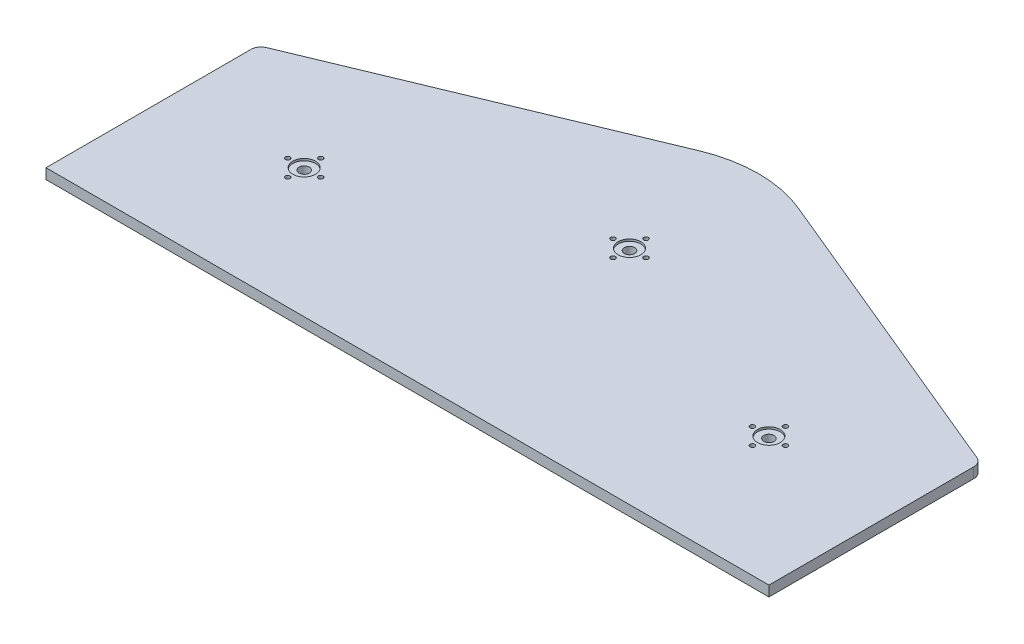
from build123d import *

# Parameters (mm, degrees)
ESQUISSE1_R                                        = 5
BOSS_EXTRU_1_DEPTH                                 = 10
ESQUISSE2_R                                        = 11
ENL_V_MAT_EXTRU_1_DEPTH                            = 2
CHAMBRAGE_POUR_VIS_T_TE_HEXAGONALE_M41_D           = 4.5
CHAMBRAGE_POUR_VIS_T_TE_HEXAGONALE_M41_CBORE_D     = 8
CHAMBRAGE_POUR_VIS_T_TE_HEXAGONALE_M41_CBORE_DEPTH = 4.4
R_P_TITION_CIRCULAIRE1_COUNT                       = 4
CHAMBRAGE_POUR_VIS_T_TE_HEXAGONALE_M42_D           = 4.5
CHAMBRAGE_POUR_VIS_T_TE_HEXAGONALE_M42_CBORE_D     = 8
CHAMBRAGE_POUR_VIS_T_TE_HEXAGONALE_M42_CBORE_DEPTH = 4.4
CHAMBRAGE_POUR_VIS_T_TE_HEXAGONALE_M43_D           = 4.5
CHAMBRAGE_POUR_VIS_T_TE_HEXAGONALE_M43_CBORE_D     = 8
CHAMBRAGE_POUR_VIS_T_TE_HEXAGONALE_M43_CBORE_DEPTH = 4.4
R_P_TITION_CIRCULAIRE2_COUNT                       = 4
R_P_TITION_CIRCULAIRE3_COUNT                       = 4


with BuildPart() as part:
    # Esquisse1 → Boss.-Extru.1 (new body)
    with BuildSketch(Plane(origin=(0, 0, 0), x_dir=(1, 0, 0), z_dir=(0, 1, 0))):
        with BuildLine():
            Line((350, 0), (-350, 0))
            Line((-350, 0), (-350, 198.324835183))
            ThreePointArc((-350, 198.324835183), (-348.317239297, 203.876729496), (-343.835293906, 207.560121895))
            Line((-343.835293906, 207.560121895), (-47.941173826, 330.441083901))
            ThreePointArc((-47.941173826, 330.441083901), (0, 340), (47.941173826, 330.441083901))
            Line((47.941173826, 330.441083901), (343.835293906, 207.560121895))
            ThreePointArc((343.835293906, 207.560121895), (348.317239297, 203.876729496), (350, 198.324835183))
            Line((350, 198.324835183), (350, 0))
        make_face()
        with Locations((0, 215)):
            Circle(ESQUISSE1_R, mode=Mode.SUBTRACT)
        with Locations((-225, 125)):
            Circle(ESQUISSE1_R, mode=Mode.SUBTRACT)
        with Locations((225, 125)):
            Circle(ESQUISSE1_R, mode=Mode.SUBTRACT)
    extrude(amount=BOSS_EXTRU_1_DEPTH)

    # Esquisse2 → Enlèv. mat.-Extru.1 (cut)
    with BuildSketch(Plane(origin=(0, 10, 0), x_dir=(1, 0, 0), z_dir=(0, 1, 0))):
        with Locations((0, 215)):
            Circle(ESQUISSE2_R)
        with Locations((225, 125)):
            Circle(ESQUISSE2_R)
        with Locations((-225, 125)):
            Circle(ESQUISSE2_R)
    extrude(amount=-ENL_V_MAT_EXTRU_1_DEPTH, mode=Mode.SUBTRACT)

    # Chambrage pour vis à tête hexagonale M41 (through all)
    with Locations(Plane(origin=(0, 0, 0), x_dir=(-1, 0, 0), z_dir=(0, -1, 0))):
        with Locations((-225, 141)):
            chambrage_pour_vis_t_te_hexagonale_m41 = CounterBoreHole(CHAMBRAGE_POUR_VIS_T_TE_HEXAGONALE_M41_D / 2, CHAMBRAGE_POUR_VIS_T_TE_HEXAGONALE_M41_CBORE_D / 2, CHAMBRAGE_POUR_VIS_T_TE_HEXAGONALE_M41_CBORE_DEPTH)

    # Répétition circulaire1: Chambrage pour vis à tête hexagonale M41 ×4 about axis
    r_p_tition_circulaire1_axis = Axis((225, 8, -125), (0, -1, 0))
    for i in range(1, R_P_TITION_CIRCULAIRE1_COUNT):
        add(chambrage_pour_vis_t_te_hexagonale_m41.rotate(r_p_tition_circulaire1_axis, i * 360 / R_P_TITION_CIRCULAIRE1_COUNT), mode=Mode.SUBTRACT)

    # Chambrage pour vis à tête hexagonale M42 (through all)
    with Locations(Plane(origin=(0, 0, 0), x_dir=(-1, 0, 0), z_dir=(0, -1, 0))):
        with Locations((0, 231)):
            chambrage_pour_vis_t_te_hexagonale_m42 = CounterBoreHole(CHAMBRAGE_POUR_VIS_T_TE_HEXAGONALE_M42_D / 2, CHAMBRAGE_POUR_VIS_T_TE_HEXAGONALE_M42_CBORE_D / 2, CHAMBRAGE_POUR_VIS_T_TE_HEXAGONALE_M42_CBORE_DEPTH)

    # Chambrage pour vis à tête hexagonale M43 (through all)
    with Locations(Plane(origin=(0, 0, 0), x_dir=(-1, 0, 0), z_dir=(0, -1, 0))):
        with Locations((225, 141)):
            chambrage_pour_vis_t_te_hexagonale_m43 = CounterBoreHole(CHAMBRAGE_POUR_VIS_T_TE_HEXAGONALE_M43_D / 2, CHAMBRAGE_POUR_VIS_T_TE_HEXAGONALE_M43_CBORE_D / 2, CHAMBRAGE_POUR_VIS_T_TE_HEXAGONALE_M43_CBORE_DEPTH)

    # Répétition circulaire2: Chambrage pour vis à tête hexagonale M42 ×4 about axis
    r_p_tition_circulaire2_axis = Axis((0, 8, -215), (0, -1, 0))
    for i in range(1, R_P_TITION_CIRCULAIRE2_COUNT):
        add(chambrage_pour_vis_t_te_hexagonale_m42.rotate(r_p_tition_circulaire2_axis, i * 360 / R_P_TITION_CIRCULAIRE2_COUNT), mode=Mode.SUBTRACT)

    # Répétition circulaire3: Chambrage pour vis à tête hexagonale M43 ×4 about axis
    r_p_tition_circulaire3_axis = Axis((-225, 8, -125), (0, -1, 0))
    for i in range(1, R_P_TITION_CIRCULAIRE3_COUNT):
        add(chambrage_pour_vis_t_te_hexagonale_m43.rotate(r_p_tition_circulaire3_axis, i * 360 / R_P_TITION_CIRCULAIRE3_COUNT), mode=Mode.SUBTRACT)


solid = part.part
